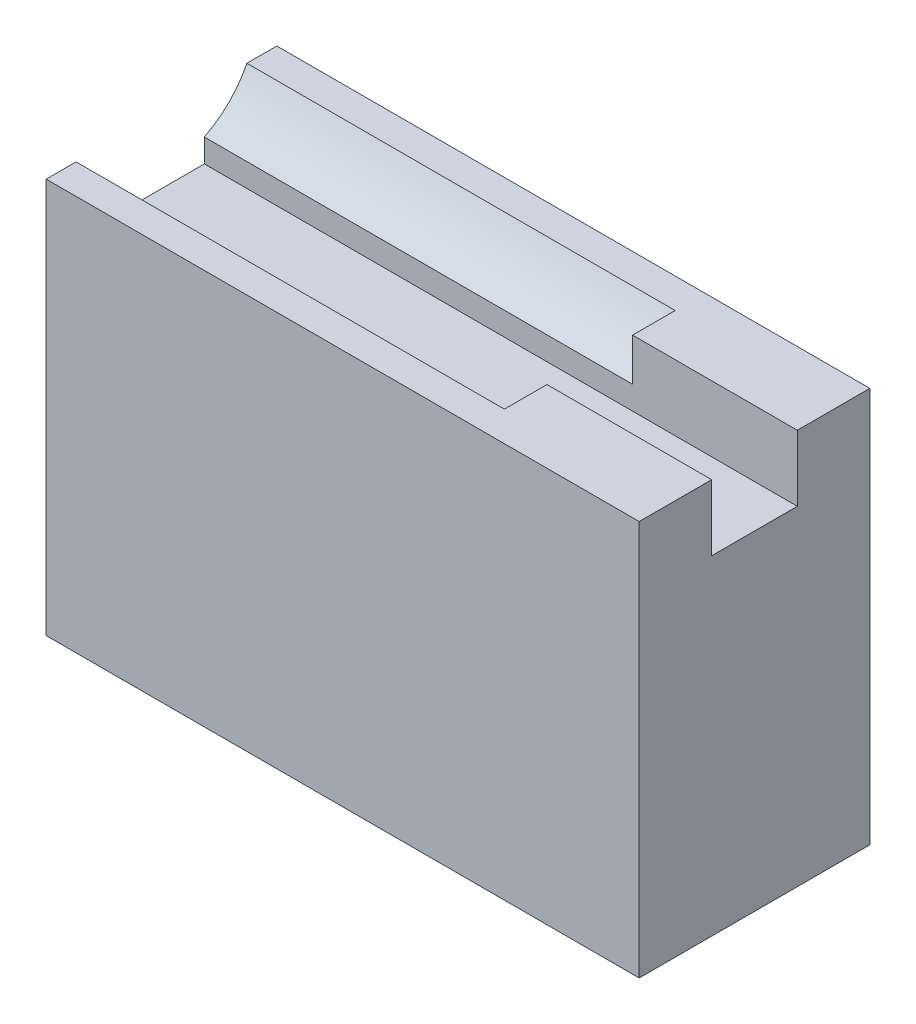
from build123d import *

# Parameters (mm, degrees)
SKETCH1_W               = 90
SKETCH1_H               = 35
BOSS_EXTRUDE1_DEPTH     = 60
SKETCH2_W               = 25
SKETCH2_H               = 13
CUT_EXTRUDE1_DEPTH      = 8
SKETCH3_R               = 14.5
CUT_EXTRUDE2_DEPTH      = 96.131487952
CUT_EXTRUDE8_DEPTH      = 110.676797911
CUT_EXTRUDE8_DEPTH_BACK = 2
SKETCH4_W               = 95.939068785
SKETCH4_H               = 13


with BuildPart() as part:
    # Sketch1 → Boss-Extrude1 (new body)
    with BuildSketch(Plane(origin=(0, 0, 0), x_dir=(1, 0, 0), z_dir=(0, 1, 0))):
        with Locations((45, -17.5)):
            Rectangle(SKETCH1_W, SKETCH1_H)
    extrude(amount=BOSS_EXTRUDE1_DEPTH)

    # Sketch2 → Cut-Extrude1 (cut)
    with BuildSketch(Plane(origin=(0, 60, 0), x_dir=(1, 0, 0), z_dir=(0, 1, 0))):
        with Locations((77.5, -17.5)):
            Rectangle(SKETCH2_W, SKETCH2_H)
    extrude(amount=-CUT_EXTRUDE1_DEPTH, mode=Mode.SUBTRACT)

    # Sketch3 → Cut-Extrude2 (cut, through all)
    with BuildSketch(Plane(origin=(65, 0, 0), x_dir=(0, 0, -1), z_dir=(1, 0, 0))):
        with Locations((-17.5, 66.5)):
            Circle(SKETCH3_R)
    extrude(amount=-CUT_EXTRUDE2_DEPTH, mode=Mode.SUBTRACT)

    # Sketch4 → Cut-Extrude8 (cut, two sides: drawn at the far end of the back side and taken through both)
    with BuildSketch(Plane(origin=(0, 52, 0), x_dir=(1, 0, 0), z_dir=(0, 1, 0)).offset(-CUT_EXTRUDE8_DEPTH_BACK)):
        with Locations((42.030465607, -17.5)):
            Rectangle(SKETCH4_W, SKETCH4_H)
    extrude(amount=CUT_EXTRUDE8_DEPTH + CUT_EXTRUDE8_DEPTH_BACK, mode=Mode.SUBTRACT)


solid = part.part
